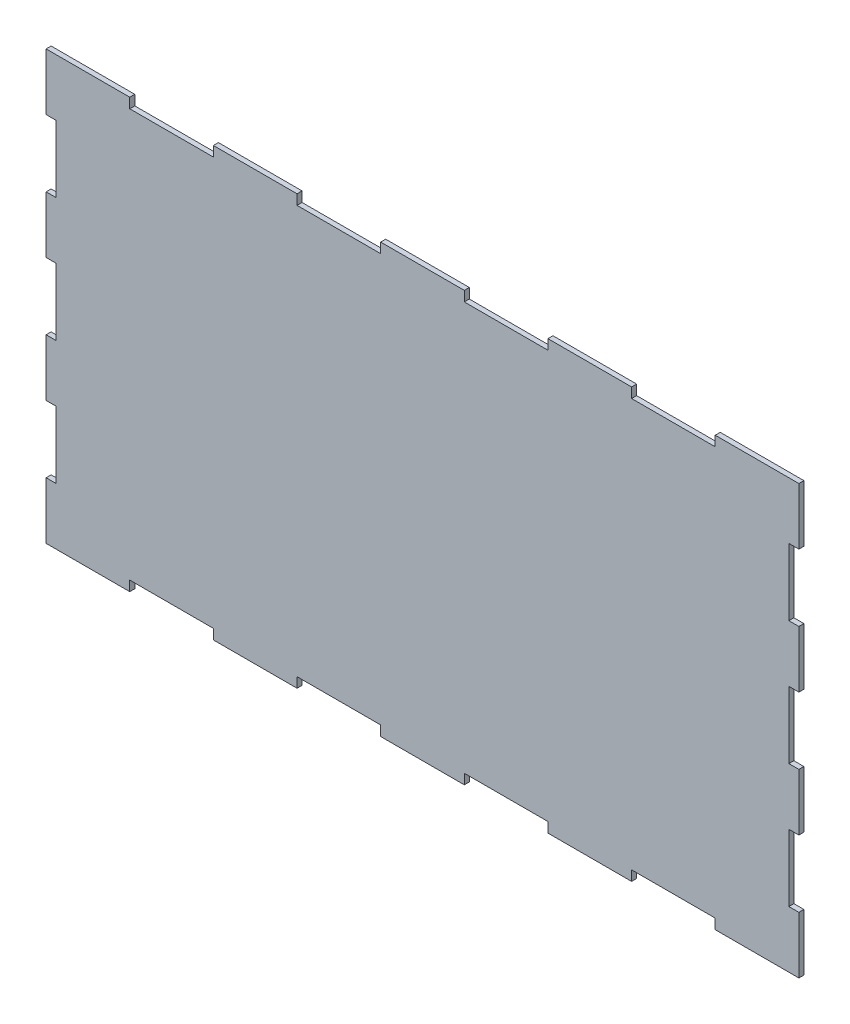
from build123d import *

# Parameters (mm, degrees)
EXTRUDE_1_DEPTH = 3


with BuildPart() as part:
    # Эскиз1 → Бобышка-Вытянуть1 (new body)
    with BuildSketch(Plane.XY):
        Polygon((100, 256), (150, 256), (150, 250), (200, 250), (200, 256), (250, 256), (250, 250), (300, 250), (300, 256), (350, 256), (350, 250), (400, 250), (400, 256), (450, 256), (450, 222), (444, 222), (444, 182), (450, 182), (450, 148), (444, 148), (444, 108), (450, 108), (450, 74), (444, 74), (444, 34), (450, 34), (450, 0), (400, 0), (400, 6), (350, 6), (350, 0), (300, 0), (300, 6), (250, 6), (250, 0), (200, 0), (200, 6), (150, 6), (150, 0), (100, 0), (100, 6), (50, 6), (50, 0), (0, 0), (0, 34), (6, 34), (6, 74), (0, 74), (0, 108), (6, 108), (6, 148), (0, 148), (0, 182), (6, 182), (6, 222), (0, 222), (0, 256), (50, 256), (50, 250), (100, 250), align=None)
    extrude(amount=EXTRUDE_1_DEPTH)


solid = part.part
